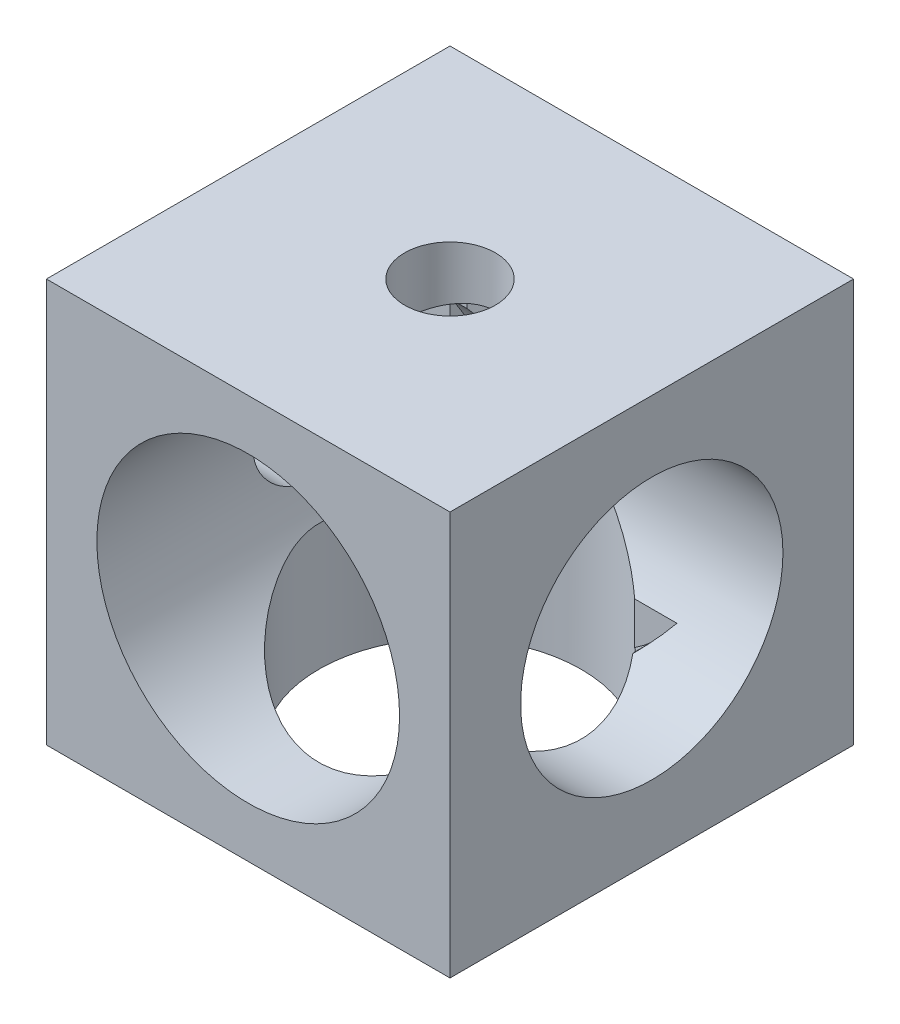
from build123d import *

# Parameters (mm, degrees)
SKETCH_1_W               = 20
SKETCH_1_H               = 20
EXTRUDE_1_DEPTH          = 20
SKETCH_2_R               = 6.5
CUT_EXTRUDE_1_DEPTH      = 15
SKETCH_3_R               = 6.5
CUT_EXTRUDE_2_DEPTH      = 15
SKETCH_4_R               = 7.5
CUT_EXTRUDE_3_DEPTH      = 15
CUT_EXTRUDE_5_DEPTH      = 25.494897509
CUT_EXTRUDE_5_DEPTH_BACK = 25.494897509
SKETCH_5_R               = 2.25
CUT_EXTRUDE_6_DEPTH      = 31.0000001
CUT_EXTRUDE_6_DEPTH_BACK = 31.0000001
SKETCH_6_R               = 2.25
CUT_EXTRUDE_7_DEPTH      = 31.0000001
CUT_EXTRUDE_7_DEPTH_BACK = 31.0000001
SKETCH_7_R               = 2.25


with BuildPart() as part:
    # 草图1 → 凸台-拉伸1 (new body)
    with BuildSketch(Plane(origin=(0, 0, 0), x_dir=(1, 0, 0), z_dir=(0, 1, 0))):
        Rectangle(SKETCH_1_W, SKETCH_1_H)
    extrude(amount=EXTRUDE_1_DEPTH)

    # 草图2 → 切除-拉伸1 (cut)
    with BuildSketch(Plane.XZ):
        with Locations(Location((0, 0, 0), (0, 0, 270))):
            Circle(SKETCH_2_R)
    extrude(amount=-CUT_EXTRUDE_1_DEPTH, mode=Mode.SUBTRACT)

    # 草图3 → 切除-拉伸2 (cut)
    with BuildSketch(Plane(origin=(10, 0, 0), x_dir=(0, 0, -1), z_dir=(1, 0, 0))):
        with Locations((0, 10)):
            Circle(SKETCH_3_R)
    extrude(amount=-CUT_EXTRUDE_2_DEPTH, mode=Mode.SUBTRACT)

    # 草图4 → 切除-拉伸3 (cut)
    with BuildSketch(Plane.XY.offset(10)):
        with Locations((0, 10)):
            Circle(SKETCH_4_R)
    extrude(amount=-CUT_EXTRUDE_3_DEPTH, mode=Mode.SUBTRACT)

    # 草图5 → 切除-拉伸5 (cut, two sides: drawn at the far end of the back side and taken through both)
    with BuildSketch(Plane.XZ.offset(-CUT_EXTRUDE_5_DEPTH_BACK)):
        with Locations(Location((0, 0, 0), (0, 0, 270))):
            Circle(SKETCH_5_R)
    extrude(amount=CUT_EXTRUDE_5_DEPTH + CUT_EXTRUDE_5_DEPTH_BACK, mode=Mode.SUBTRACT)

    # 草图6 → 切除-拉伸6 (cut, two sides: drawn at the far end of the back side and taken through both)
    with BuildSketch(Plane.XY.offset(10).offset(-CUT_EXTRUDE_6_DEPTH_BACK)):
        with Locations((0, 10)):
            Circle(SKETCH_6_R)
    extrude(amount=CUT_EXTRUDE_6_DEPTH + CUT_EXTRUDE_6_DEPTH_BACK, mode=Mode.SUBTRACT)

    # 草图7 → 切除-拉伸7 (cut, two sides: drawn at the far end of the back side and taken through both)
    with BuildSketch(Plane(origin=(10, 0, 0), x_dir=(0, 0, -1), z_dir=(1, 0, 0)).offset(-CUT_EXTRUDE_7_DEPTH_BACK)):
        with Locations((0, 10)):
            Circle(SKETCH_7_R)
    extrude(amount=CUT_EXTRUDE_7_DEPTH + CUT_EXTRUDE_7_DEPTH_BACK, mode=Mode.SUBTRACT)


solid = part.part
